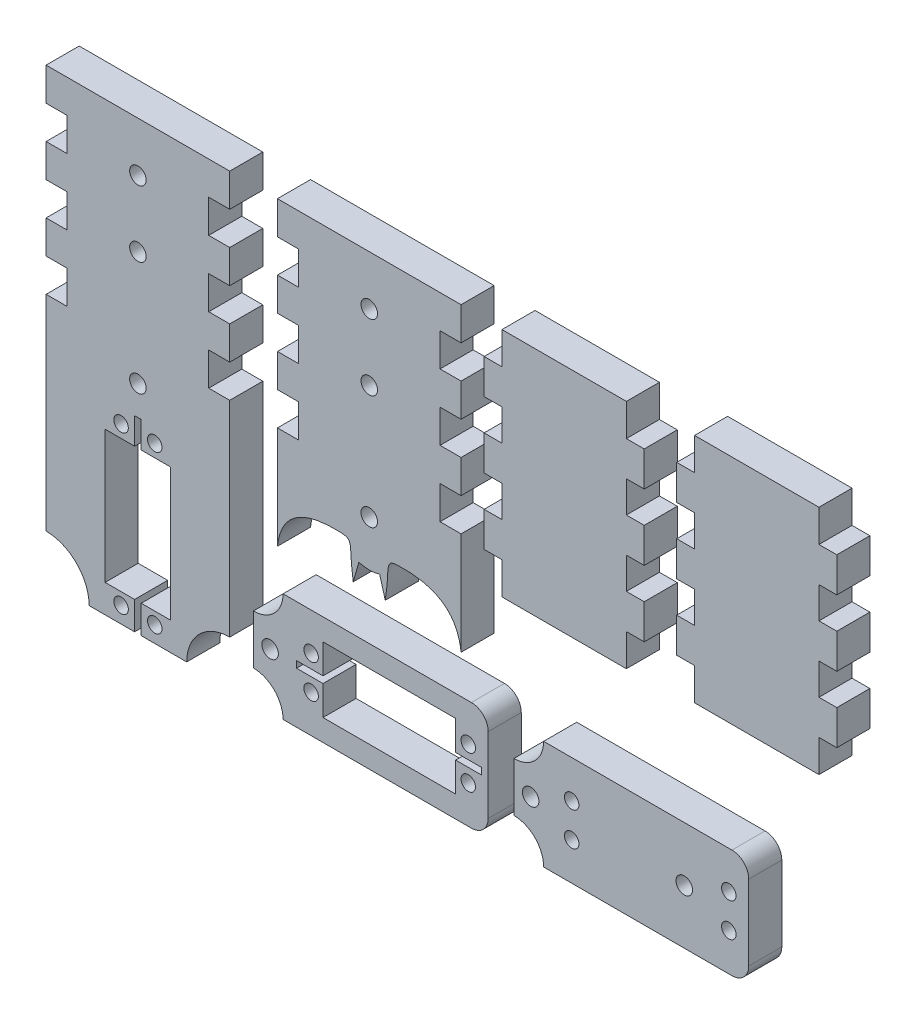
from build123d import *

# Parameters (mm, degrees)
SKETCH1_R             = 2.5
SKETCH1_R_2           = 2.19
BOSS_EXTRUDE1_DEPTH   = 10
BOSS_EXTRUDE1_2_DEPTH = 10
BOSS_EXTRUDE1_3_DEPTH = 10
BOSS_EXTRUDE1_4_DEPTH = 10
BOSS_EXTRUDE1_5_DEPTH = 10
BOSS_EXTRUDE1_6_DEPTH = 10


with BuildPart() as part:
    # Sketch1 → Boss-Extrude1 (new body)
    with BuildSketch(Plane.XY):
        with BuildLine():
            ThreePointArc((-4559.899187859, 576.206575684), (-4561.38708541, 579.798678132), (-4564.979187859, 581.286575684))
            Line((-4564.979187859, 581.286575684), (-4621.899187859, 581.286575684))
            ThreePointArc((-4621.899187859, 581.286575684), (-4624.535226828, 574.922614653), (-4630.899187859, 572.286575684))
            Line((-4630.899187859, 572.286575684), (-4630.899187859, 557.386575684))
            ThreePointArc((-4630.899187859, 557.386575684), (-4624.535226828, 554.750536714), (-4621.899187859, 548.386575684))
            Line((-4621.899187859, 548.386575684), (-4564.979187859, 548.386575684))
            ThreePointArc((-4564.979187859, 548.386575684), (-4561.38708541, 549.874473235), (-4559.899187859, 553.466575684))
            Line((-4559.899187859, 553.466575684), (-4559.899187859, 576.206575684))
        make_face()
        with Locations((-4625.8176125, 564.836575684)):
            Circle(SKETCH1_R, mode=Mode.SUBTRACT)
        with Locations((-4613.419340347, 559.751575684)):
            Circle(SKETCH1_R_2, mode=Mode.SUBTRACT)
        Polygon((-4561.899187859, 563.836575684), (-4569.729340347, 563.836575684), (-4569.729340347, 554.926575684), (-4609.829340347, 554.926575684), (-4609.829340347, 563.836575684), (-4617.829340347, 563.836575684), (-4617.829340347, 565.836575684), (-4609.829340347, 565.836575684), (-4609.829340347, 574.746575684), (-4569.729340347, 574.746575684), (-4569.729340347, 565.836575684), (-4561.899187859, 565.836575684), align=None, mode=Mode.SUBTRACT)
        with Locations((-4613.419340347, 569.921575684)):
            Circle(SKETCH1_R_2, mode=Mode.SUBTRACT)
        with Locations((-4565.919340347, 559.751575684)):
            Circle(SKETCH1_R_2, mode=Mode.SUBTRACT)
        with Locations((-4565.919340347, 569.921575684)):
            Circle(SKETCH1_R_2, mode=Mode.SUBTRACT)
    extrude(amount=BOSS_EXTRUDE1_DEPTH)


with BuildPart() as body_2:
    # Sketch1 → Boss-Extrude1 2 (new body)
    with BuildSketch(Plane.XY):
        with BuildLine():
            ThreePointArc((-4543.138334812, 582.045930659), (-4545.774373781, 575.681969629), (-4552.138334812, 573.045930659))
            Line((-4552.138334812, 573.045930659), (-4552.138334812, 558.145930659))
            ThreePointArc((-4552.138334812, 558.145930659), (-4545.774373781, 555.50989169), (-4543.138334812, 549.145930659))
            Line((-4543.138334812, 549.145930659), (-4486.218334812, 549.145930659))
            ThreePointArc((-4486.218334812, 549.145930659), (-4482.626232363, 550.633828211), (-4481.138334812, 554.225930659))
            Line((-4481.138334812, 554.225930659), (-4481.138334812, 576.965930659))
            ThreePointArc((-4481.138334812, 576.965930659), (-4482.626232363, 580.558033108), (-4486.218334812, 582.045930659))
            Line((-4486.218334812, 582.045930659), (-4543.138334812, 582.045930659))
        make_face()
        with Locations((-4534.6584873, 560.510930659)):
            Circle(SKETCH1_R_2, mode=Mode.SUBTRACT)
        with Locations((-4547.056759453, 565.595930659)):
            Circle(SKETCH1_R, mode=Mode.SUBTRACT)
        with Locations((-4534.6584873, 570.680930659)):
            Circle(SKETCH1_R_2, mode=Mode.SUBTRACT)
        with Locations((-4487.1584873, 560.510930659)):
            Circle(SKETCH1_R_2, mode=Mode.SUBTRACT)
        with Locations((-4500.6284873, 565.595930659)):
            Circle(SKETCH1_R, mode=Mode.SUBTRACT)
        with Locations((-4487.1584873, 570.680930659)):
            Circle(SKETCH1_R_2, mode=Mode.SUBTRACT)
    extrude(amount=BOSS_EXTRUDE1_2_DEPTH)


with BuildPart() as body_3:
    # Sketch1 → Boss-Extrude1 3 (new body)
    with BuildSketch(Plane.XY):
        with BuildLine():
            Line((-4644.375792774, 663.876425426), (-4644.375792774, 673.876425426))
            Line((-4644.375792774, 673.876425426), (-4638.025792774, 673.876425426))
            Line((-4638.025792774, 673.876425426), (-4638.025792774, 683.87642543))
            Line((-4638.025792774, 683.87642543), (-4693.525792774, 683.87642543))
            Line((-4693.525792774, 683.87642543), (-4693.525792774, 673.87642543))
            Line((-4693.525792774, 673.87642543), (-4687.175792774, 673.87642543))
            Line((-4687.175792774, 673.87642543), (-4687.175792774, 663.87642543))
            Line((-4687.175792774, 663.87642543), (-4693.525792774, 663.87642543))
            Line((-4693.525792774, 663.87642543), (-4693.525792774, 653.87642543))
            Line((-4693.525792774, 653.87642543), (-4687.175792774, 653.87642543))
            Line((-4687.175792774, 653.87642543), (-4687.175792774, 643.87642543))
            Line((-4687.175792774, 643.87642543), (-4693.525792774, 643.87642543))
            Line((-4693.525792774, 643.87642543), (-4693.525792774, 633.87642543))
            Line((-4693.525792774, 633.87642543), (-4687.175792774, 633.87642543))
            Line((-4687.175792774, 633.87642543), (-4687.175792774, 623.87642543))
            Line((-4687.175792774, 623.87642543), (-4693.525792774, 623.87642543))
            Line((-4693.525792774, 623.87642543), (-4693.525792774, 561.87642543))
            ThreePointArc((-4693.525792774, 561.87642543), (-4684.333404619, 558.068813585), (-4680.525792774, 548.87642543))
            Line((-4680.525792774, 548.87642543), (-4666.775792774, 548.87642543))
            Line((-4666.775792774, 548.87642543), (-4666.775792774, 557.37642543))
            Line((-4666.775792774, 557.37642543), (-4675.685792774, 557.37642543))
            Line((-4675.685792774, 557.37642543), (-4675.685792774, 597.47642543))
            Line((-4675.685792774, 597.47642543), (-4666.775792774, 597.47642543))
            Line((-4666.775792774, 597.47642543), (-4666.775792774, 605.47642543))
            Line((-4666.775792774, 605.47642543), (-4664.775792774, 605.47642543))
            Line((-4664.775792774, 605.47642543), (-4664.775792774, 597.47642543))
            Line((-4664.775792774, 597.47642543), (-4655.865792774, 597.47642543))
            Line((-4655.865792774, 597.47642543), (-4655.865792774, 557.37642543))
            Line((-4655.865792774, 557.37642543), (-4664.775792774, 557.37642543))
            Line((-4664.775792774, 557.37642543), (-4664.775792774, 548.87642543))
            Line((-4664.775792774, 548.87642543), (-4651.025792774, 548.87642543))
            ThreePointArc((-4651.025792774, 548.87642543), (-4647.218180929, 558.068813585), (-4638.025792774, 561.87642543))
            Line((-4638.025792774, 561.87642543), (-4638.025792774, 623.87642543))
            Line((-4638.025792774, 623.87642543), (-4644.375792774, 623.87642543))
            Line((-4644.375792774, 623.87642543), (-4644.375792774, 633.876425426))
            Line((-4644.375792774, 633.876425426), (-4638.025792774, 633.876425426))
            Line((-4638.025792774, 633.876425426), (-4638.025792774, 643.876425426))
            Line((-4638.025792774, 643.876425426), (-4644.375792774, 643.876425426))
            Line((-4644.375792774, 643.876425426), (-4644.375792774, 653.876425426))
            Line((-4644.375792774, 653.876425426), (-4638.025792774, 653.876425426))
            Line((-4638.025792774, 653.876425426), (-4638.025792774, 663.876425426))
            Line((-4638.025792774, 663.876425426), (-4644.375792774, 663.876425426))
        make_face()
        with Locations((-4670.860792774, 553.78642543)):
            Circle(SKETCH1_R_2, mode=Mode.SUBTRACT)
        with Locations((-4660.690792774, 553.78642543)):
            Circle(SKETCH1_R_2, mode=Mode.SUBTRACT)
        with Locations((-4670.860792774, 601.28642543)):
            Circle(SKETCH1_R_2, mode=Mode.SUBTRACT)
        with Locations((-4665.775792774, 614.37642543)):
            Circle(SKETCH1_R, mode=Mode.SUBTRACT)
        with Locations((-4660.690792774, 601.28642543)):
            Circle(SKETCH1_R_2, mode=Mode.SUBTRACT)
        with Locations((-4665.775792774, 648.87642543)):
            Circle(SKETCH1_R, mode=Mode.SUBTRACT)
        with Locations((-4665.775792774, 668.87642543)):
            Circle(SKETCH1_R, mode=Mode.SUBTRACT)
    extrude(amount=BOSS_EXTRUDE1_3_DEPTH)


with BuildPart() as body_4:
    # Sketch1 → Boss-Extrude1 4 (new body)
    with BuildSketch(Plane.XY):
        Polygon((-4497.514537051, 635.188529832), (-4502.914537051, 635.188529832), (-4502.914537051, 624.688529832), (-4497.514537051, 624.688529832), (-4497.514537051, 614.938529832), (-4459.914537051, 614.938529832), (-4459.914537051, 624.688529832), (-4454.514537051, 624.688529832), (-4454.514537051, 635.188529832), (-4459.914537051, 635.188529832), (-4459.914537051, 644.688529832), (-4454.514537051, 644.688529832), (-4454.514537051, 655.188529832), (-4459.914537051, 655.188529832), (-4459.914537051, 664.688529832), (-4454.514537051, 664.688529832), (-4454.514537051, 675.188529832), (-4459.914537051, 675.188529832), (-4459.914537051, 684.938529832), (-4497.514537051, 684.938529832), (-4497.514537051, 675.188529832), (-4502.914537051, 675.188529832), (-4502.914537051, 664.688529832), (-4497.514537051, 664.688529832), (-4497.514537051, 655.188529832), (-4502.914537051, 655.188529832), (-4502.914537051, 644.688529832), (-4497.514537051, 644.688529832), align=None)
    extrude(amount=BOSS_EXTRUDE1_4_DEPTH)


with BuildPart() as body_5:
    # Sketch1 → Boss-Extrude1 5 (new body)
    with BuildSketch(Plane.XY):
        with BuildLine():
            Line((-4600.687577002, 595.03237653), (-4598.977021343, 601.021416956))
            add(Edge.make_bspline(
                [(-4595.844845441, 600.541809529), (-4597.285634306, 600.547750046), (-4598.977021343, 601.021416956)],
                knots=[0, 0, 0, 1, 1, 1], degree=2))
            add(Edge.make_bspline(
                [(-4595.844845441, 600.541809529), (-4594.404056575, 600.547750046), (-4592.712669538, 601.021416956)],
                knots=[0, 0, 0, 1, 1, 1], degree=2))
            Line((-4592.712669538, 601.021416956), (-4591.00211388, 595.03237653))
            add(Edge.make_bspline(
                [(-4591.00211388, 595.03237653), (-4589.499808534, 604.097639386), (-4591.503391594, 605.896683109), (-4587.129571206, 606.06848669)],
                knots=[0, 0, 0, 0, 1, 1, 1, 1], degree=3))
            add(Edge.make_bspline(
                [(-4587.129571206, 606.06848669), (-4569.632956641, 606.735069089), (-4568.094845442, 592.87642543)],
                knots=[0, 0, 0, 1, 1, 1], degree=2))
            Line((-4568.094845442, 592.87642543), (-4568.094845442, 623.87642543))
            Line((-4568.094845442, 623.87642543), (-4574.444845442, 623.87642543))
            Line((-4574.444845442, 623.87642543), (-4574.444845442, 633.87642543))
            Line((-4574.444845442, 633.87642543), (-4568.094845442, 633.87642543))
            Line((-4568.094845442, 633.87642543), (-4568.094845442, 643.87642543))
            Line((-4568.094845442, 643.87642543), (-4574.444845442, 643.87642543))
            Line((-4574.444845442, 643.87642543), (-4574.444845442, 653.87642543))
            Line((-4574.444845442, 653.87642543), (-4568.094845442, 653.87642543))
            Line((-4568.094845442, 653.87642543), (-4568.094845442, 663.87642543))
            Line((-4568.094845442, 663.87642543), (-4574.444845442, 663.87642543))
            Line((-4574.444845442, 663.87642543), (-4574.444845442, 673.87642543))
            Line((-4574.444845442, 673.87642543), (-4568.094845442, 673.87642543))
            Line((-4568.094845442, 673.87642543), (-4568.094845442, 683.87642543))
            Line((-4568.094845442, 683.87642543), (-4623.59484544, 683.87642543))
            Line((-4623.59484544, 683.87642543), (-4623.59484544, 673.87642543))
            Line((-4623.59484544, 673.87642543), (-4617.24484544, 673.87642543))
            Line((-4617.24484544, 673.87642543), (-4617.24484544, 663.87642543))
            Line((-4617.24484544, 663.87642543), (-4623.59484544, 663.87642543))
            Line((-4623.59484544, 663.87642543), (-4623.59484544, 653.87642543))
            Line((-4623.59484544, 653.87642543), (-4617.24484544, 653.87642543))
            Line((-4617.24484544, 653.87642543), (-4617.24484544, 643.87642543))
            Line((-4617.24484544, 643.87642543), (-4623.59484544, 643.87642543))
            Line((-4623.59484544, 643.87642543), (-4623.59484544, 633.87642543))
            Line((-4623.59484544, 633.87642543), (-4617.24484544, 633.87642543))
            Line((-4617.24484544, 633.87642543), (-4617.24484544, 623.87642543))
            Line((-4617.24484544, 623.87642543), (-4623.59484544, 623.87642543))
            Line((-4623.59484544, 623.87642543), (-4623.59484544, 592.87642543))
            add(Edge.make_bspline(
                [(-4604.560119675, 606.06848669), (-4622.056734241, 606.735069089), (-4623.59484544, 592.87642543)],
                knots=[0, 0, 0, 1, 1, 1], degree=2))
            add(Edge.make_bspline(
                [(-4600.687577002, 595.03237653), (-4602.189882348, 604.097639386), (-4600.186299287, 605.896683109), (-4604.560119675, 606.06848669)],
                knots=[0, 0, 0, 0, 1, 1, 1, 1], degree=3))
        make_face()
        with Locations((-4595.844845441, 614.37642543)):
            Circle(SKETCH1_R, mode=Mode.SUBTRACT)
        with Locations((-4595.844845441, 648.87642543)):
            Circle(SKETCH1_R, mode=Mode.SUBTRACT)
        with Locations((-4595.844845441, 668.87642543)):
            Circle(SKETCH1_R, mode=Mode.SUBTRACT)
    extrude(amount=BOSS_EXTRUDE1_5_DEPTH)


with BuildPart() as body_6:
    # Sketch1 → Boss-Extrude1 6 (new body)
    with BuildSketch(Plane.XY):
        Polygon((-4555.730819701, 633.794159194), (-4561.130819701, 633.794159194), (-4561.130819701, 623.294159194), (-4555.730819701, 623.294159194), (-4555.730819701, 613.544159194), (-4518.130819701, 613.544159194), (-4518.130819701, 623.294159194), (-4512.730819701, 623.294159194), (-4512.730819701, 633.794159194), (-4518.130819701, 633.794159194), (-4518.130819701, 643.294159194), (-4512.730819701, 643.294159194), (-4512.730819701, 653.794159194), (-4518.130819701, 653.794159194), (-4518.130819701, 663.294159194), (-4512.730819701, 663.294159194), (-4512.730819701, 673.794159194), (-4518.130819701, 673.794159194), (-4518.130819701, 683.544159194), (-4555.730819701, 683.544159194), (-4555.730819701, 673.794159194), (-4561.130819701, 673.794159194), (-4561.130819701, 663.294159194), (-4555.730819701, 663.294159194), (-4555.730819701, 653.794159194), (-4561.130819701, 653.794159194), (-4561.130819701, 643.294159194), (-4555.730819701, 643.294159194), align=None)
    extrude(amount=BOSS_EXTRUDE1_6_DEPTH)


solid = Compound([part.part, body_2.part, body_3.part, body_4.part, body_5.part, body_6.part])
